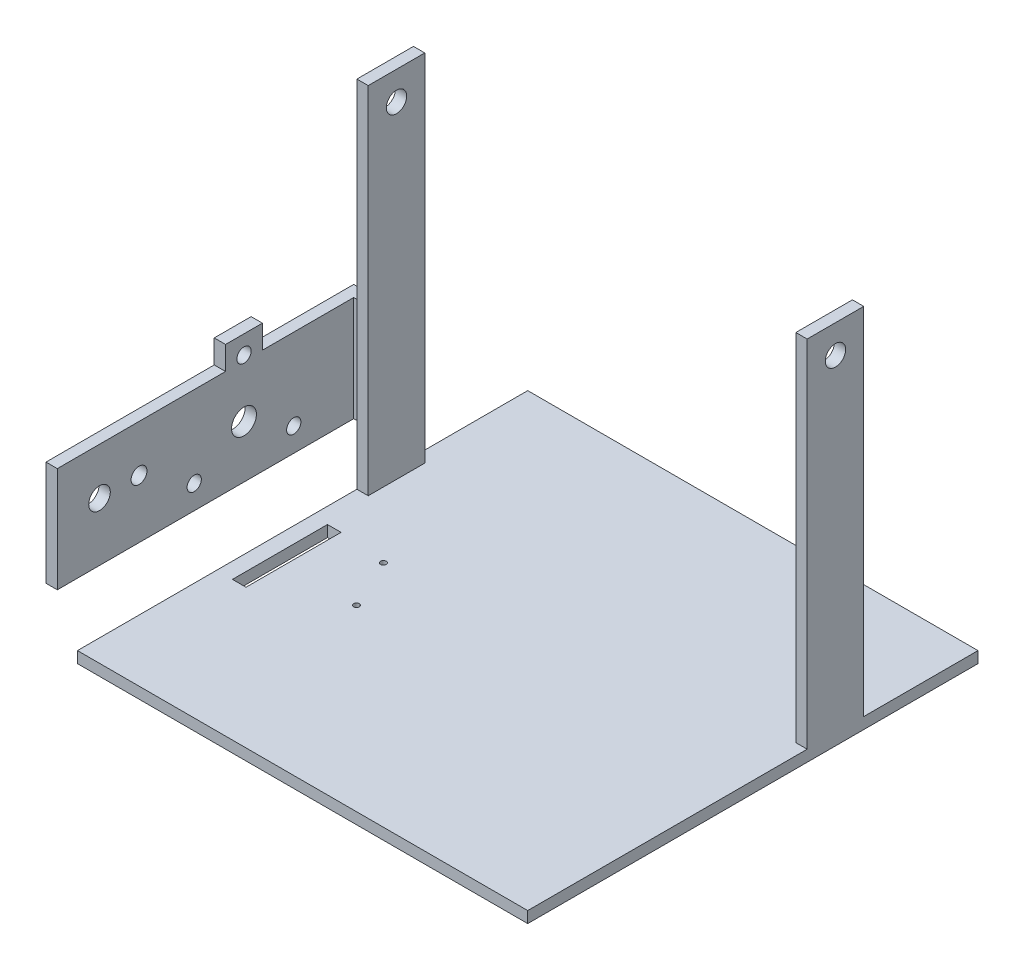
from build123d import *

# Parameters (mm, degrees)
SKETCH1_W                 = 199
SKETCH1_H                 = 199
BOSS_EXTRUDE1_DEPTH       = 5
SKETCH2_W                 = 5
SKETCH2_H                 = 25
BOSS_EXTRUDE2_DEPTH       = 18.8
SKETCH3_W                 = 5
SKETCH3_H                 = 25
BOSS_EXTRUDE3_DEPTH       = 46.4
SKETCH4_W                 = 5
SKETCH4_H                 = 25
BOSS_EXTRUDE4_DEPTH       = 91.8
SKETCH5_W                 = 5
SKETCH5_H                 = 25
BOSS_EXTRUDE5_DEPTH       = 157
SKETCH6_R                 = 4.5
CUT_EXTRUDE1_DEPTH        = 325.724498614
SKETCH8_W                 = 5
SKETCH8_H                 = 46.4
BOSS_EXTRUDE6_DEPTH       = 13.9
SKETCH9_W                 = 5
SKETCH9_H                 = 46.4
BOSS_EXTRUDE7_DEPTH       = 131
SKETCH11_W                = 16.3
SKETCH11_H                = 10.35
BOSS_EXTRUDE8_DEPTH       = 5
SKETCH10_R                = 5.5
SKETCH10_R_2              = 3.15
CUT_EXTRUDE2_DEPTH        = 5
SKETCH12_W                = 6
SKETCH12_H                = 42
CUT_EXTRUDE3_DEPTH        = 5
SKETCH17_R                = 3.5
CUT_EXTRUDE7_DEPTH        = 9
M3X0_5_TAPPED_HOLE1_D     = 2.5
M3X0_5_TAPPED_HOLE1_DEPTH = 7.5
M3X0_5_TAPPED_HOLE1_TIP   = 0.751075774
SKETCH20_R                = 4.7625
CUT_EXTRUDE8_DEPTH        = 10


with BuildPart() as part:
    # Sketch1 → Boss-Extrude1 (new body)
    with BuildSketch(Plane(origin=(0, 0, 0), x_dir=(1, 0, 0), z_dir=(0, 1, 0))):
        with Locations((99.5, -99.5)):
            Rectangle(SKETCH1_W, SKETCH1_H)
    extrude(amount=BOSS_EXTRUDE1_DEPTH)

    # Sketch2 → Boss-Extrude2 (add)
    with BuildSketch(Plane(origin=(0, 5, 0), x_dir=(1, 0, 0), z_dir=(0, 1, 0))):
        with Locations((2.5, -63)):
            Rectangle(SKETCH2_W, SKETCH2_H)
    extrude(amount=BOSS_EXTRUDE2_DEPTH)

    # Sketch3 → Boss-Extrude3 (add)
    with BuildSketch(Plane(origin=(0, 23.8, 0), x_dir=(1, 0, 0), z_dir=(0, 1, 0))):
        with Locations((2.5, -63)):
            Rectangle(SKETCH3_W, SKETCH3_H)
    extrude(amount=BOSS_EXTRUDE3_DEPTH)

    # Sketch4 → Boss-Extrude4 (add)
    with BuildSketch(Plane(origin=(0, 70.2, 0), x_dir=(1, 0, 0), z_dir=(0, 1, 0))):
        with Locations((2.5, -63)):
            Rectangle(SKETCH4_W, SKETCH4_H)
    extrude(amount=BOSS_EXTRUDE4_DEPTH)

    # Sketch5 → Boss-Extrude5 (add)
    with BuildSketch(Plane(origin=(0, 5, 0), x_dir=(1, 0, 0), z_dir=(0, 1, 0))):
        with Locations((196.5, -63)):
            Rectangle(SKETCH5_W, SKETCH5_H)
    extrude(amount=BOSS_EXTRUDE5_DEPTH)

    # Sketch6 → Cut-Extrude1 (cut, through all)
    with BuildSketch(Plane.ZY):
        with Locations((63, 149.5)):
            Circle(SKETCH6_R)
    extrude(amount=-CUT_EXTRUDE1_DEPTH, mode=Mode.SUBTRACT)

    # Sketch8 → Boss-Extrude6 (add)
    with BuildSketch(Plane.ZY):
        with Locations((65.5, 47)):
            Rectangle(SKETCH8_W, SKETCH8_H)
    extrude(amount=BOSS_EXTRUDE6_DEPTH)

    # Sketch9 → Boss-Extrude7 (add)
    with BuildSketch(Plane.XY.offset(68)):
        with Locations((-11.4, 47)):
            Rectangle(SKETCH9_W, SKETCH9_H)
    extrude(amount=BOSS_EXTRUDE7_DEPTH)

    # Sketch11 → Boss-Extrude8 (add)
    with BuildSketch(Plane.ZY.offset(13.9)):
        with Locations((116.5, 75.375)):
            Rectangle(SKETCH11_W, SKETCH11_H)
    extrude(amount=-BOSS_EXTRUDE8_DEPTH)

    # Sketch10 → Cut-Extrude2 (cut)
    with BuildSketch(Plane.ZY.offset(13.9)):
        with Locations((116.5, 47)):
            Circle(SKETCH10_R)
        with Locations((116.5, 72.4)):
            Circle(SKETCH10_R_2)
        with Locations((138.497045256, 34.3)):
            Circle(SKETCH10_R_2)
        with Locations((94.502954744, 34.3)):
            Circle(SKETCH10_R_2)
    extrude(amount=-CUT_EXTRUDE2_DEPTH, mode=Mode.SUBTRACT)

    # Sketch12 → Cut-Extrude3 (cut)
    with BuildSketch(Plane(origin=(0, 5, 0), x_dir=(1, 0, 0), z_dir=(0, 1, 0))):
        with Locations((10, -116.5)):
            Rectangle(SKETCH12_W, SKETCH12_H)
    extrude(amount=-CUT_EXTRUDE3_DEPTH, mode=Mode.SUBTRACT)

    # Sketch17 → Cut-Extrude7 (cut)
    with BuildSketch(Plane.ZY.offset(13.9)):
        with Locations((162.886026442, 49.5625)):
            Circle(SKETCH17_R)
    extrude(amount=-CUT_EXTRUDE7_DEPTH, mode=Mode.SUBTRACT)

    # M3x0.5 Tapped Hole1
    with Locations(Plane(origin=(0, 5, 0), x_dir=(1, 0, 0), z_dir=(0, 1, 0))):
        with Locations((34, -97.8), (44.31875, -120)):
            Hole(M3X0_5_TAPPED_HOLE1_D / 2, depth=M3X0_5_TAPPED_HOLE1_DEPTH)
            with Locations((0, 0, -(M3X0_5_TAPPED_HOLE1_DEPTH + M3X0_5_TAPPED_HOLE1_TIP / 2))):  # 118° drill point
                Cone(0, M3X0_5_TAPPED_HOLE1_D / 2, M3X0_5_TAPPED_HOLE1_TIP, mode=Mode.SUBTRACT)

    # Sketch20 → Cut-Extrude8 (cut)
    with BuildSketch(Plane.ZY.offset(13.9)):
        with Locations((180.348526442, 49.5625)):
            Circle(SKETCH20_R)
    extrude(amount=-CUT_EXTRUDE8_DEPTH, mode=Mode.SUBTRACT)


solid = part.part
